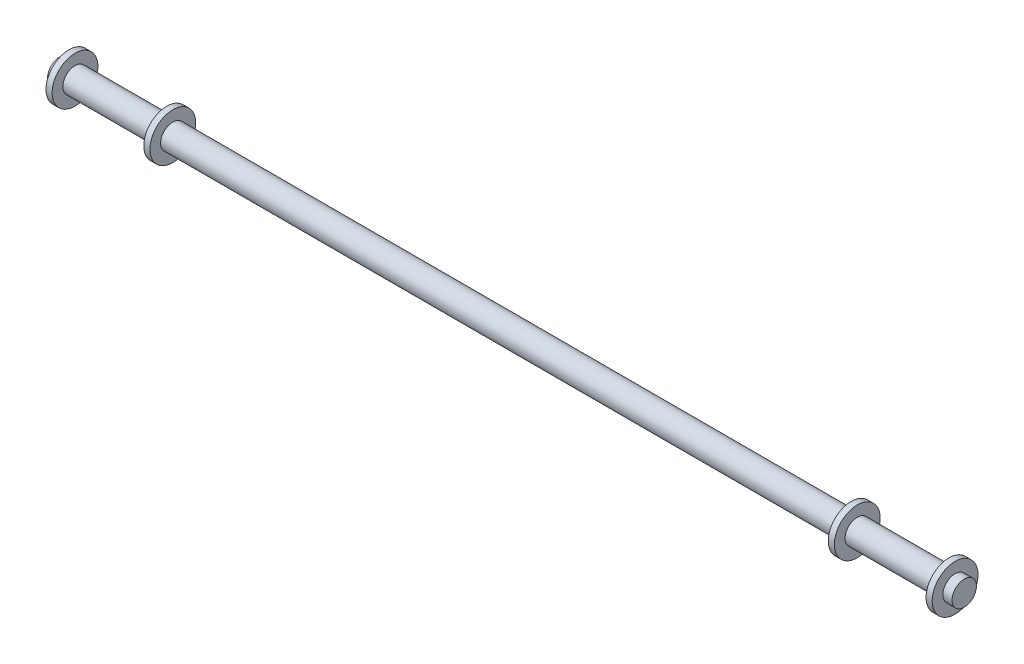
from build123d import *

# Parameters (mm, degrees)
SKETCH1_R           = 10.16
BOSS_EXTRUDE1_DEPTH = 375.92
BOSS_EXTRUDE2_START = -12.7
SKETCH2_R           = 19.05
BOSS_EXTRUDE2_DEPTH = 5.08
BOSS_EXTRUDE3_START = -93.98
SKETCH3_R           = 19.05
BOSS_EXTRUDE3_DEPTH = 5.08
BOSS_EXTRUDE4_START = -7.62
SKETCH4_R           = 19.05
BOSS_EXTRUDE4_DEPTH = 5.08
BOSS_EXTRUDE5_START = -88.9
SKETCH5_R           = 19.05
BOSS_EXTRUDE5_DEPTH = 5.08


with BuildPart() as part:
    # Sketch1 → Boss-Extrude1 (new, symmetric)
    with BuildSketch(Plane(origin=(0, 0, 0), x_dir=(0, 0, -1), z_dir=(1, 0, 0))):
        Circle(SKETCH1_R)
    extrude(amount=BOSS_EXTRUDE1_DEPTH, both=True)

    # Sketch2 → Boss-Extrude2 (add)
    with BuildSketch(Plane.ZY.offset(375.92).offset(BOSS_EXTRUDE2_START)):
        Circle(SKETCH2_R)
    extrude(amount=BOSS_EXTRUDE2_DEPTH)

    # Sketch3 → Boss-Extrude3 (add)
    with BuildSketch(Plane.ZY.offset(375.92).offset(BOSS_EXTRUDE3_START)):
        Circle(SKETCH3_R)
    extrude(amount=BOSS_EXTRUDE3_DEPTH)

    # Sketch4 → Boss-Extrude4 (add)
    with BuildSketch(Plane(origin=(375.92, 0, 0), x_dir=(0, 0, -1), z_dir=(1, 0, 0)).offset(BOSS_EXTRUDE4_START)):
        with Locations(Location((0, 0, 0), (0, 0, 180))):
            Circle(SKETCH4_R)
    extrude(amount=-BOSS_EXTRUDE4_DEPTH)

    # Sketch5 → Boss-Extrude5 (add)
    with BuildSketch(Plane(origin=(375.92, 0, 0), x_dir=(0, 0, -1), z_dir=(1, 0, 0)).offset(BOSS_EXTRUDE5_START)):
        with Locations(Location((0, 0, 0), (0, 0, 180))):
            Circle(SKETCH5_R)
    extrude(amount=-BOSS_EXTRUDE5_DEPTH)


solid = part.part
